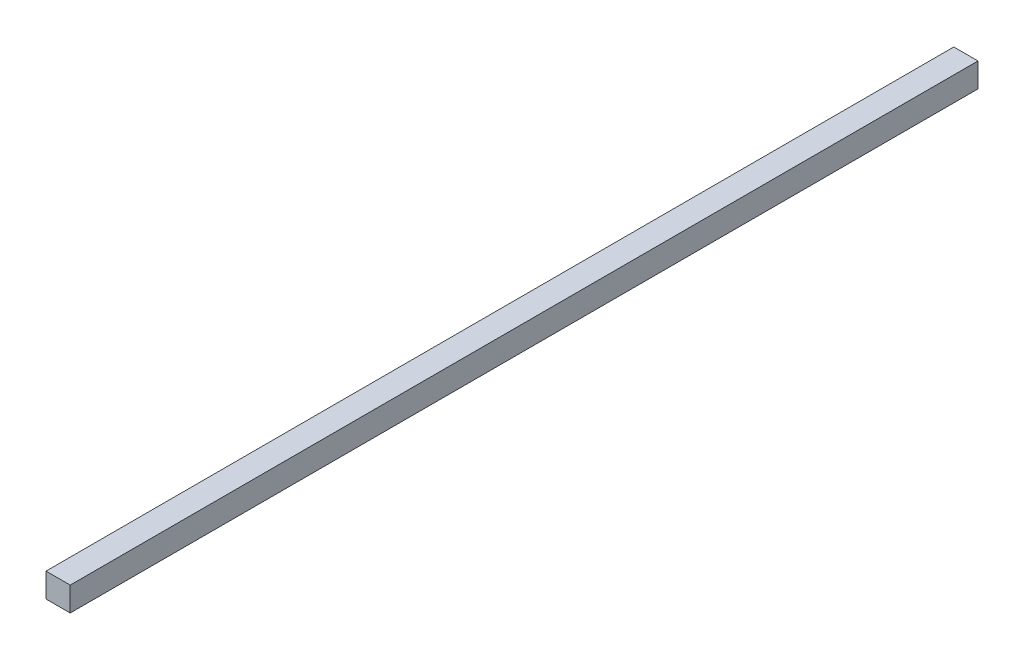
from build123d import *

# Parameters (mm, degrees)
SKETCH_1_W      = 20
SKETCH_1_H      = 20
EXTRUDE_1_DEPTH = 750


with BuildPart() as part:
    # 草图1 → 凸台-拉伸1 (new body)
    with BuildSketch(Plane.XY):
        Rectangle(SKETCH_1_W, SKETCH_1_H)
    extrude(amount=EXTRUDE_1_DEPTH)


solid = part.part
